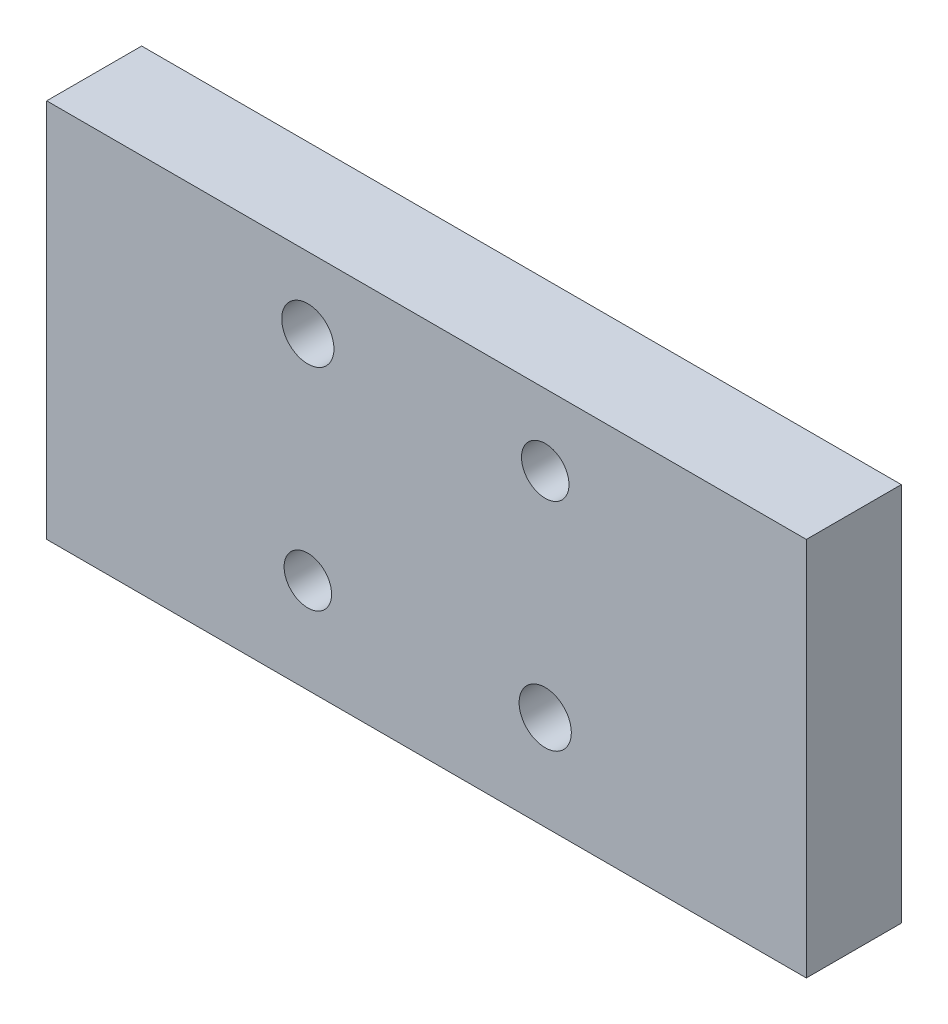
from build123d import *

# Parameters (mm, degrees)
SKETCH_1_W          = 160
SKETCH_1_H          = 80
EXTRUDE_1_DEPTH     = 20
HOLE_WIZARD_M10_1_D = 11
MM_1_D              = 10


with BuildPart() as part:
    # 草图1 → 凸台-拉伸1 (new body)
    with BuildSketch(Plane.XY):
        Rectangle(SKETCH_1_W, SKETCH_1_H)
    extrude(amount=EXTRUDE_1_DEPTH)

    # M10 间隙孔1 (through all)
    with Locations(Plane.XY.offset(20)):
        with Locations((-25, 25), (25, -20)):
            Hole(HOLE_WIZARD_M10_1_D / 2)

    # 大小mm 暗销孔1 (through all)
    with Locations(Plane.XY.offset(20)):
        with Locations((25, 25), (-25, -20)):
            Hole(MM_1_D / 2)


solid = part.part
